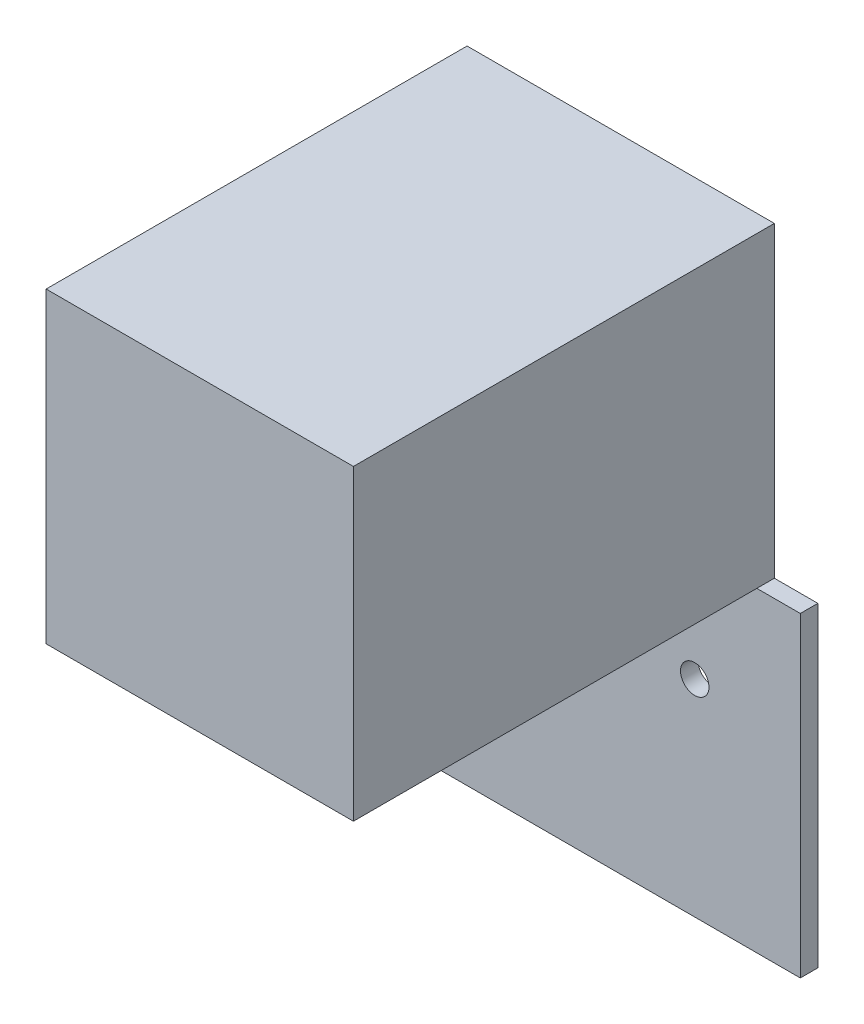
from build123d import *

# Parameters (mm, degrees)
SKETCH1_W           = 174.752
SKETCH1_H           = 114.3
BOSS_EXTRUDE1_DEPTH = 6.35
SKETCH2_W           = 111.252
SKETCH2_H           = 111.252
BOSS_EXTRUDE2_DEPTH = 152.4
SKETCH3_R           = 5.1562
CUT_EXTRUDE1_DEPTH  = 324.47755132


with BuildPart() as part:
    # Sketch1 → Boss-Extrude1 (new body)
    with BuildSketch(Plane.XY):
        with Locations((87.376, 57.15)):
            Rectangle(SKETCH1_W, SKETCH1_H)
    extrude(amount=BOSS_EXTRUDE1_DEPTH)

    # Sketch2 → Boss-Extrude2 (add)
    with BuildSketch(Plane.XY):
        with Locations((103.378, 169.926)):
            Rectangle(SKETCH2_W, SKETCH2_H)
    extrude(amount=BOSS_EXTRUDE2_DEPTH)

    # Sketch3 → Cut-Extrude1 (cut, through all)
    with BuildSketch(Plane.XY):
        with Locations(Location((73.025, 74.6252, 0), (0, 0, 180))):
            Circle(SKETCH3_R)
        with Locations(Location((136.525, 74.6252, 0), (0, 0, 180))):
            Circle(SKETCH3_R)
    extrude(amount=CUT_EXTRUDE1_DEPTH, mode=Mode.SUBTRACT)


solid = part.part
